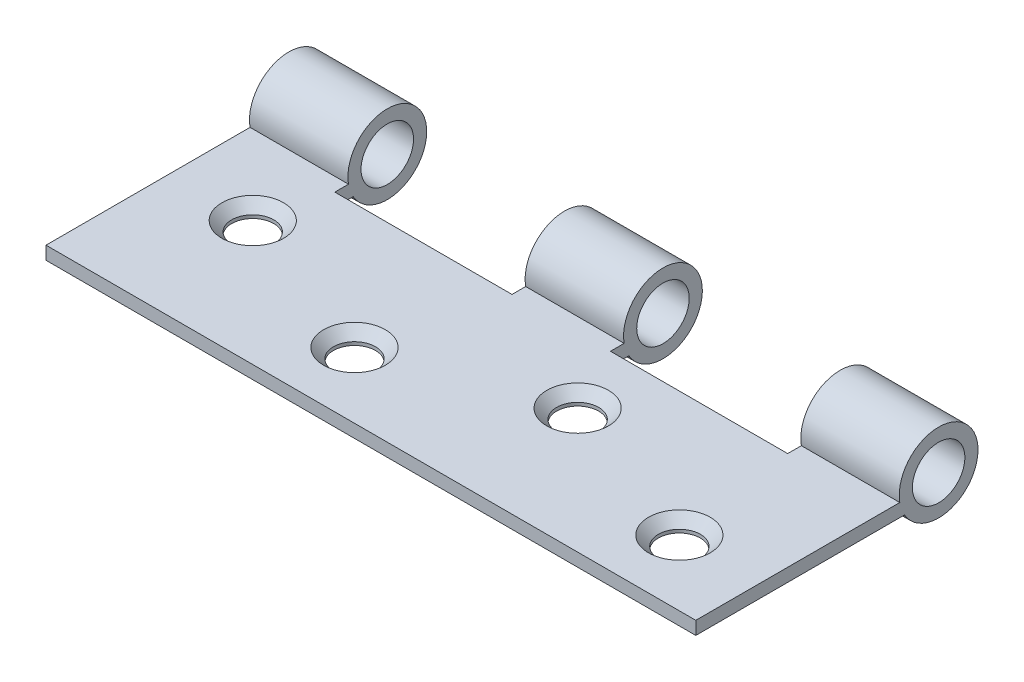
from build123d import *

# Parameters (mm, degrees)
SKETCH_1_R               = 6
SKETCH_1_R_2             = 4
EXTRUDE_1_DEPTH          = 99
SKETCH_2_W               = 99
SKETCH_2_H               = 2
EXTRUDE_2_DEPTH          = 37
SKETCH_3_R               = 4
CUT_EXTRUDE_1_DEPTH      = 106.858395983
CUT_EXTRUDE_2_DEPTH      = 106.919780967
CUT_EXTRUDE_2_DEPTH_BACK = 106.919780967
SKETCH_4_W               = 27
SKETCH_4_H               = 14
SKETCH_7_R               = 3.2
CUT_EXTRUDE_8_DEPTH      = 37
CHAMFER_1_SIZE           = 1.5


with BuildPart() as part:
    # 草图1 → 凸台-拉伸1 (new body)
    with BuildSketch(Plane(origin=(0, 0, 0), x_dir=(0, 0, -1), z_dir=(1, 0, 0))):
        Circle(SKETCH_1_R)
        Circle(SKETCH_1_R_2, mode=Mode.SUBTRACT)
    extrude(amount=EXTRUDE_1_DEPTH)

    # 草图2 → 凸台-拉伸2 (add)
    with BuildSketch(Plane.XY):
        with Locations((49.5, -2)):
            Rectangle(SKETCH_2_W, SKETCH_2_H)
    extrude(amount=EXTRUDE_2_DEPTH)

    # 草图3 → 切除-拉伸1 (cut, through all)
    with BuildSketch(Plane.ZY):
        with Locations(Location((0, 0, 0), (0, 0, 180))):
            Circle(SKETCH_3_R)
    extrude(amount=-CUT_EXTRUDE_1_DEPTH, mode=Mode.SUBTRACT)

    # 草图4 → 切除-拉伸2 (cut, two sides: drawn at the far end of the back side and taken through both)
    with BuildSketch(Plane(origin=(0, -1, 0), x_dir=(1, 0, 0), z_dir=(0, 1, 0)).offset(-CUT_EXTRUDE_2_DEPTH_BACK)):
        with Locations((28.5, -1)):
            Rectangle(SKETCH_4_W, SKETCH_4_H)
        with Locations((70.5, -1)):
            Rectangle(SKETCH_4_W, SKETCH_4_H)
    extrude(amount=CUT_EXTRUDE_2_DEPTH + CUT_EXTRUDE_2_DEPTH_BACK, mode=Mode.SUBTRACT)

    # 草图7 → 切除-拉伸8 (cut)
    with BuildSketch(Plane.XZ.offset(3)):
        with Locations((12.5, 18)):
            Circle(SKETCH_7_R)
        with Locations((37, 27)):
            Circle(SKETCH_7_R)
        with Locations((62, 18)):
            Circle(SKETCH_7_R)
        with Locations((86.5, 27)):
            Circle(SKETCH_7_R)
    extrude(amount=-CUT_EXTRUDE_8_DEPTH, mode=Mode.SUBTRACT)

    # 倒角1
    chamfer_1_edges = [part.edges().sort_by_distance(p)[0] for p in [
        (9.3, -1, 18),
        (33.8, -1, 27),
        (58.8, -1, 18),
        (83.3, -1, 27),
    ]]
    chamfer(chamfer_1_edges, length=CHAMFER_1_SIZE)


solid = part.part
